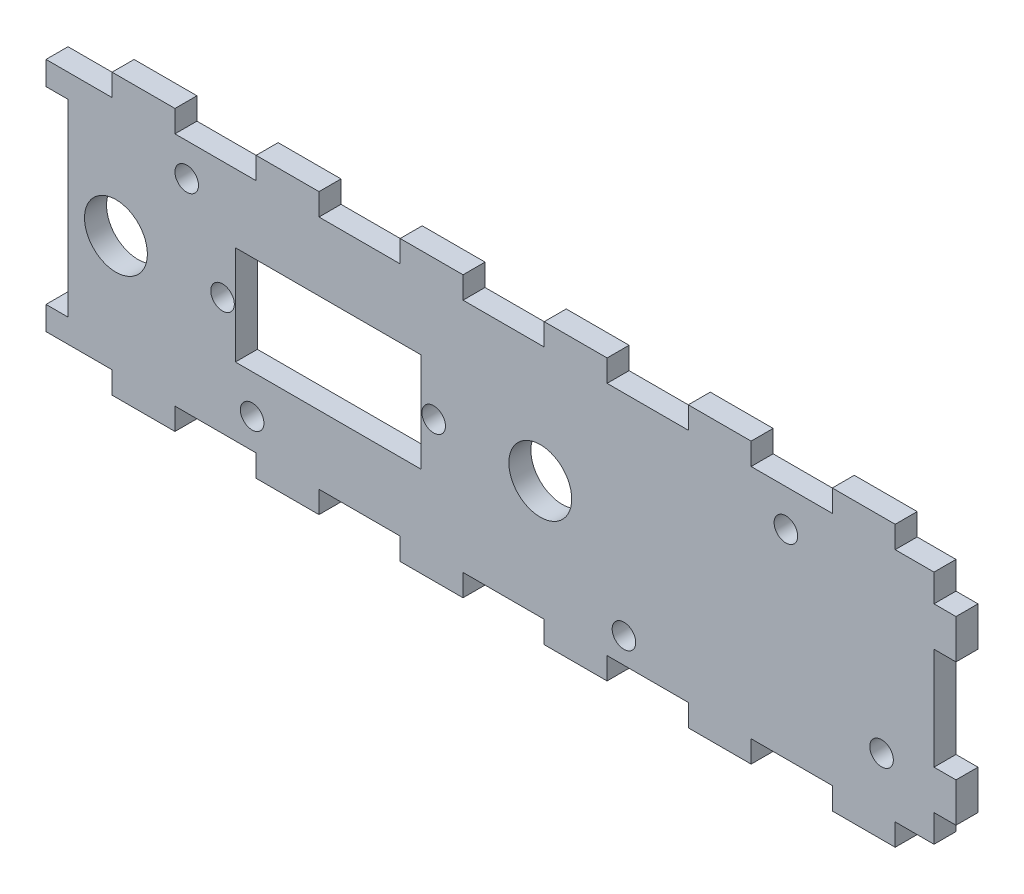
from build123d import *

# Parameters (mm, degrees)
SKETCH_1_R               = 4
EXTRUDE_1_DEPTH          = 1.4
CUT_EXTRUDE_1_DEPTH      = 61.639013844
CUT_EXTRUDE_1_DEPTH_BACK = 61.639013844
SKETCH_2_W               = 23.6
SKETCH_2_H               = 12.6
SKETCH_2_R               = 1.5
CUT_EXTRUDE_2_DEPTH      = 61.639013844
CUT_EXTRUDE_2_DEPTH_BACK = 61.639013844
SKETCH_3_R               = 1.5
SKETCH_3_R_2             = 1.499999999
SKETCH_3_R_3             = 1.500000004


with BuildPart() as part:
    # Эскиз1 → Бобышка-Вытянуть1 (new, symmetric)
    with BuildSketch(Plane.XY):
        Polygon((-55.1, 15), (-49.49, 15), (-49.49, 17.8), (-41.49, 17.8), (-41.49, 15), (-31.16, 15), (-31.16, 17.8), (-23.16, 17.8), (-23.16, 15), (-12.83, 15), (-12.83, 17.8), (-4.83, 17.8), (-4.83, 15), (5.5, 15), (5.5, 17.8), (13.5, 17.8), (13.5, 15), (23.83, 15), (23.83, 17.8), (31.83, 17.8), (31.83, 15), (42.16, 15), (42.16, 17.8), (50.16, 17.8), (50.16, 15), (55.1, 15), (55.1, 11.5), (57.9, 11.5), (57.9, 6.5), (55.1, 6.5), (55.1, 5), (55.1, -5), (55.1, -6.5), (57.9, -6.5), (57.9, -11.5), (55.1, -11.5), (55.1, -15), (50.16, -15), (50.16, -17.8), (42.16, -17.8), (42.16, -15), (31.83, -15), (31.83, -17.8), (23.83, -17.8), (23.83, -15), (13.5, -15), (13.5, -17.8), (5.5, -17.8), (5.5, -15), (-4.83, -15), (-4.83, -17.8), (-12.83, -17.8), (-12.83, -15), (-23.16, -15), (-23.16, -17.8), (-31.16, -17.8), (-31.16, -15), (-41.49, -15), (-41.49, -17.8), (-49.49, -17.8), (-49.49, -15), (-55.1, -15), (-57.9, -15), (-57.9, -12), (-55.1, -12), (-55.1, -11.5), (-55.1, -6.5), (-55.1, -5), (-55.1, 5), (-55.1, 6.5), (-55.1, 11.5), (-55.1, 12), (-57.9, 12), (-57.9, 15), align=None)
        with Locations((5, 0)):
            Circle(SKETCH_1_R, mode=Mode.SUBTRACT)
        with Locations((-49, 0)):
            Circle(SKETCH_1_R, mode=Mode.SUBTRACT)
    extrude(amount=EXTRUDE_1_DEPTH, both=True)

    # Эскиз2 → Вырез-Вытянуть1 (cut, two sides: drawn at the far end of the back side and taken through both)
    with BuildSketch(Plane(origin=(0, 0, -1.4), x_dir=(-1, 0, 0), z_dir=(0, 0, -1)).offset(-CUT_EXTRUDE_1_DEPTH_BACK)):
        with Locations((22, 0)):
            Rectangle(SKETCH_2_W, SKETCH_2_H)
        with Locations((8.565, 0)):
            Circle(SKETCH_2_R)
        with Locations((35.435, 0)):
            Circle(SKETCH_2_R)
    extrude(amount=CUT_EXTRUDE_1_DEPTH + CUT_EXTRUDE_1_DEPTH_BACK, mode=Mode.SUBTRACT)

    # Эскиз3 → Вырез-Вытянуть2 (cut, two sides: drawn at the far end of the back side and taken through both)
    with BuildSketch(Plane(origin=(0, 0, -1.4), x_dir=(-1, 0, 0), z_dir=(0, 0, -1)).offset(-CUT_EXTRUDE_2_DEPTH_BACK)):
        with Locations((31.667851618, -11.228512478)):
            Circle(SKETCH_3_R)
        with Locations((-48.429379636, -8.299999991)):
            Circle(SKETCH_3_R_2)
        with Locations((-15.648202479, -11.743667469)):
            Circle(SKETCH_3_R_2)
        with Locations((39.99236744, 10.8145639)):
            Circle(SKETCH_3_R)
        with Locations((-36.253127984, 10.284376689)):
            Circle(SKETCH_3_R_3)
    extrude(amount=CUT_EXTRUDE_2_DEPTH + CUT_EXTRUDE_2_DEPTH_BACK, mode=Mode.SUBTRACT)


solid = part.part
